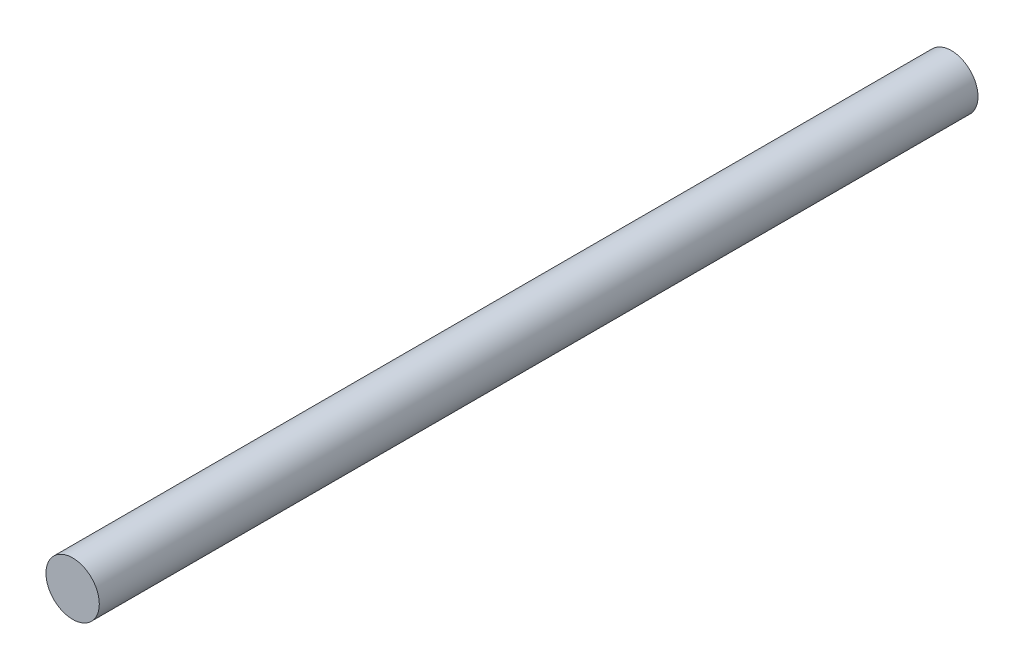
from build123d import *

# Parameters (mm, degrees)
ESQUISSE1_R        = 8.5
BOSS_EXTRU_1_DEPTH = 280


with BuildPart() as part:
    # Esquisse1 → Boss.-Extru.1 (new body)
    with BuildSketch(Plane.XY):
        Circle(ESQUISSE1_R)
    extrude(amount=BOSS_EXTRU_1_DEPTH)


solid = part.part
